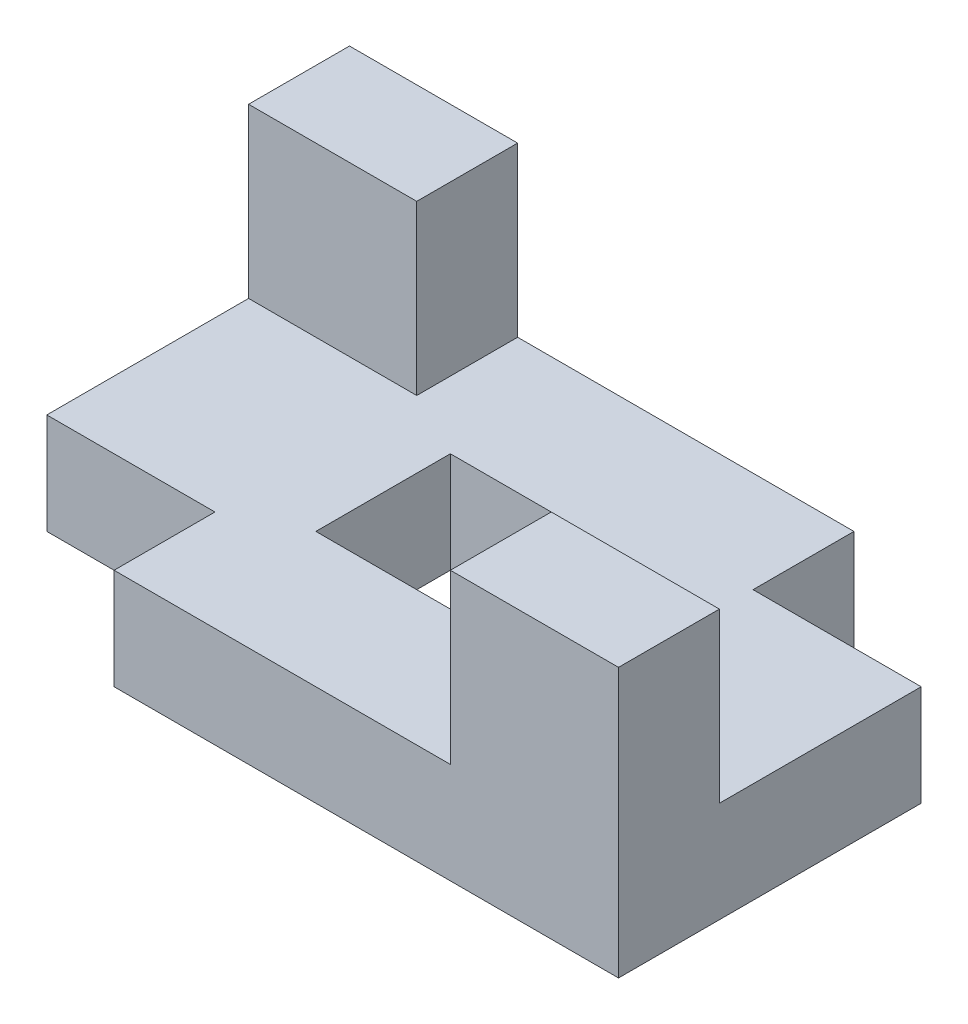
from build123d import *

# Parameters (mm, degrees)
SKETCH1_W           = 100
SKETCH1_H           = 60
BOSS_EXTRUDE1_DEPTH = 15
SKETCH3_W           = 25
SKETCH3_H           = 15
BOSS_EXTRUDE3_DEPTH = 25
SKETCH3_6_W         = 25
SKETCH3_6_H         = 15
BOSS_EXTRUDE5_DEPTH = 25
SKETCH6_W           = 25
SKETCH6_H           = 15
CUT_EXTRUDE1_DEPTH  = 64.442887702
SKETCH6_3_W         = 25
SKETCH6_3_H         = 15
CUT_EXTRUDE2_DEPTH  = 64.442887702
SKETCH7_W           = 30
SKETCH7_H           = 20
CUT_EXTRUDE3_DEPTH  = 64.442887702


with BuildPart() as part:
    # Sketch1 → Boss-Extrude1 (new body)
    with BuildSketch(Plane(origin=(0, 0, 0), x_dir=(1, 0, 0), z_dir=(0, 1, 0))):
        Rectangle(SKETCH1_W, SKETCH1_H)
    extrude(amount=BOSS_EXTRUDE1_DEPTH)

    # Sketch3 → Boss-Extrude3 (add)
    with BuildSketch(Plane(origin=(0, 15, 0), x_dir=(1, 0, 0), z_dir=(0, 1, 0))):
        with Locations((-37.5, 22.5)):
            Rectangle(SKETCH3_W, SKETCH3_H)
    extrude(amount=BOSS_EXTRUDE3_DEPTH)

    # Sketch3<6> → Boss-Extrude5 (add)
    with BuildSketch(Plane(origin=(0, 15, 0), x_dir=(1, 0, 0), z_dir=(0, 1, 0))):
        with Locations((37.5, -22.5)):
            Rectangle(SKETCH3_6_W, SKETCH3_6_H)
    extrude(amount=BOSS_EXTRUDE5_DEPTH)

    # Sketch6 → Cut-Extrude1 (cut, through all)
    with BuildSketch(Plane(origin=(0, 15, 0), x_dir=(1, 0, 0), z_dir=(0, 1, 0))):
        with Locations((-37.5, -22.5)):
            Rectangle(SKETCH6_W, SKETCH6_H)
    extrude(amount=-CUT_EXTRUDE1_DEPTH, mode=Mode.SUBTRACT)

    # Sketch6<3> → Cut-Extrude2 (cut, through all)
    with BuildSketch(Plane(origin=(0, 15, 0), x_dir=(1, 0, 0), z_dir=(0, 1, 0))):
        with Locations((37.5, 22.5)):
            Rectangle(SKETCH6_3_W, SKETCH6_3_H)
        with Locations((-37.5, -22.5)):
            Rectangle(SKETCH6_3_W, SKETCH6_3_H)
    extrude(amount=-CUT_EXTRUDE2_DEPTH, mode=Mode.SUBTRACT)

    # Sketch7 → Cut-Extrude3 (cut, through all)
    with BuildSketch(Plane(origin=(0, 15, 0), x_dir=(1, 0, 0), z_dir=(0, 1, 0))):
        Rectangle(SKETCH7_W, SKETCH7_H)
    extrude(amount=-CUT_EXTRUDE3_DEPTH, mode=Mode.SUBTRACT)


solid = part.part
